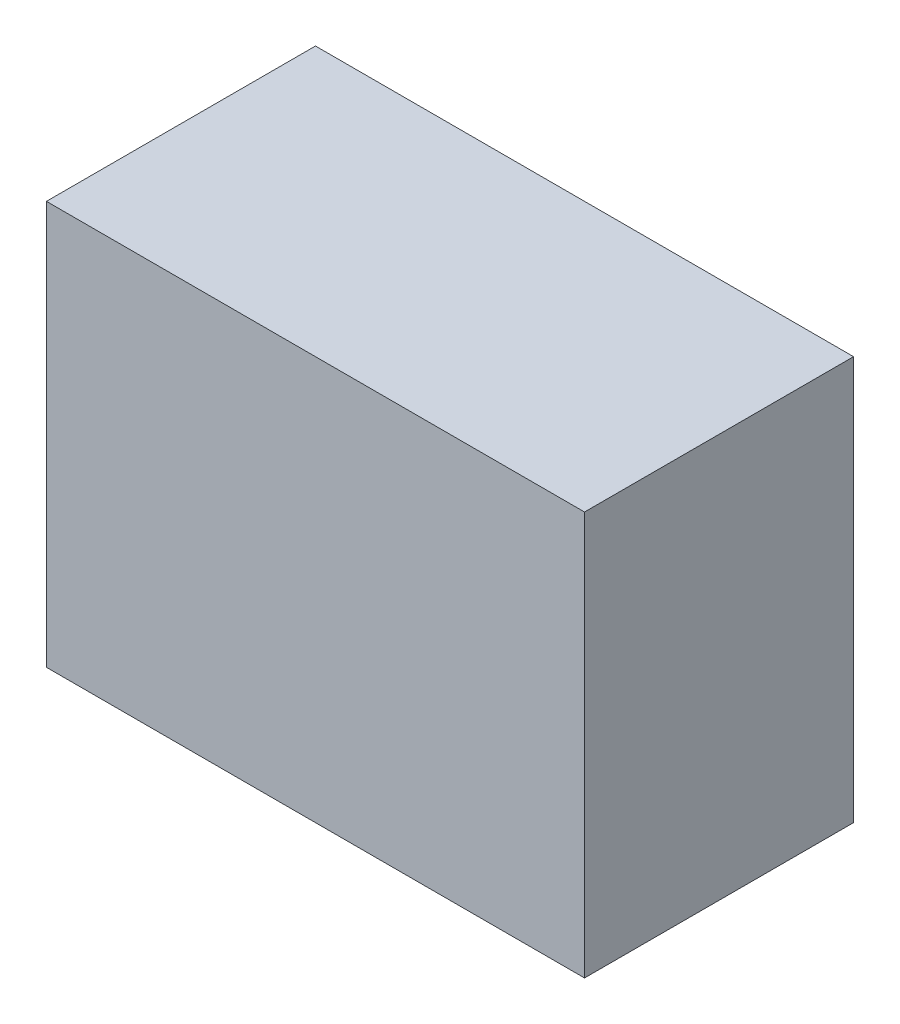
from build123d import *

# Parameters (mm, degrees)
SKETCH1_W           = 400
SKETCH1_H           = 300
BOSS_EXTRUDE1_DEPTH = 200


with BuildPart() as part:
    # Sketch1 → Boss-Extrude1 (new body)
    with BuildSketch(Plane.XY):
        with Locations((200, 150)):
            Rectangle(SKETCH1_W, SKETCH1_H)
    extrude(amount=BOSS_EXTRUDE1_DEPTH)


solid = part.part
